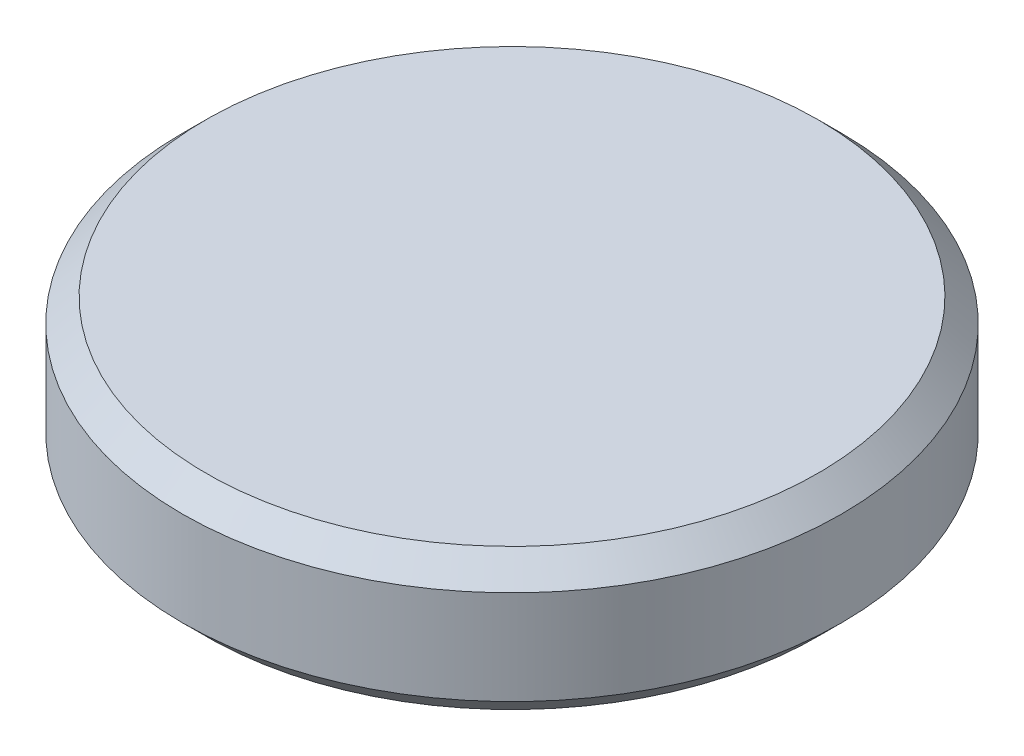
from build123d import *


with BuildPart() as part:
    # Sketch1 → Revolve1 (revolve)
    with BuildSketch(Plane.XY, mode=Mode.PRIVATE) as revolve1_sk:
        Polygon((0, 0), (6.5, 0), (7, -0.5), (7, -2.5), (6.5, -3), (1.5, -3), (1.5, -6), (0, -6), align=None)
    revolve(revolve1_sk.sketch.rotate(Axis((0, -9.89299526, 0), (0, 1, 0)), 90), axis=Axis((0, -9.89299526, 0), (0, 1, 0)))


solid = part.part
